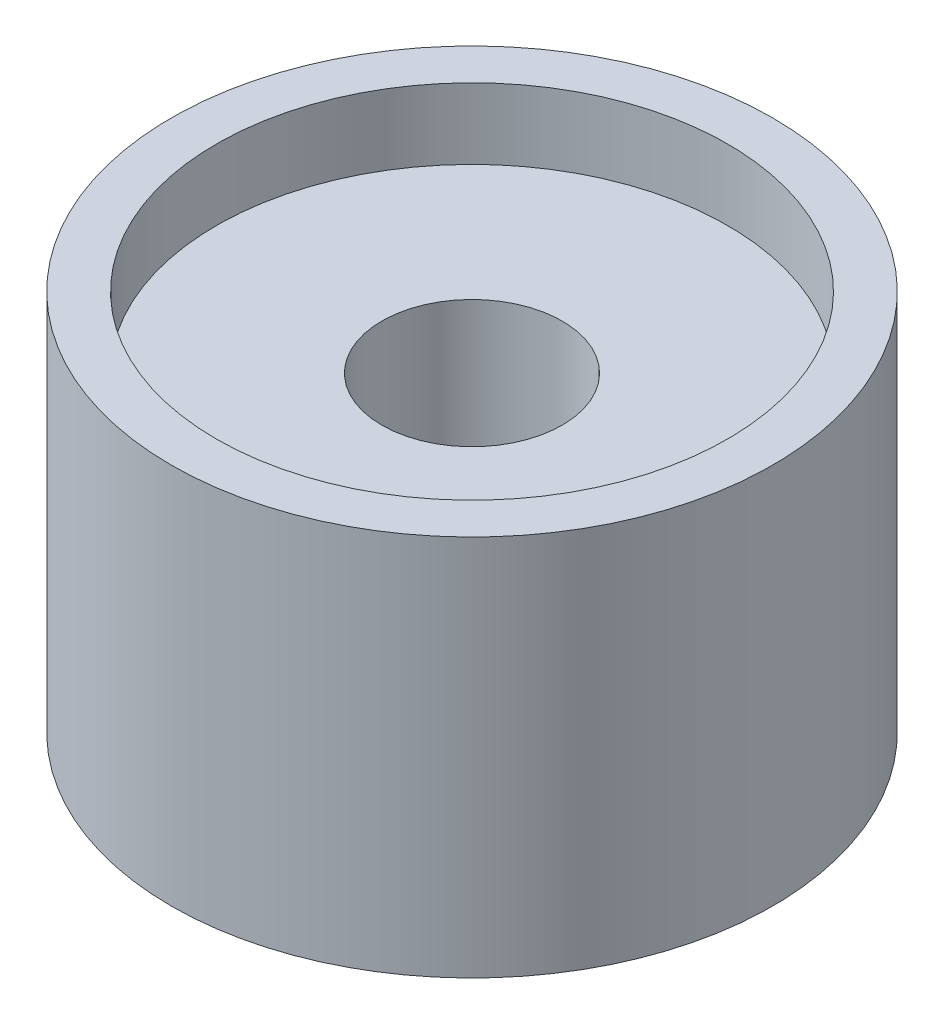
from build123d import *

# Parameters (mm, degrees)
SKETCH1_R           = 100
SKETCH1_R_2         = 85
BOSS_EXTRUDE1_DEPTH = 63.5
SKETCH4_R           = 85
SKETCH4_R_2         = 30
BOSS_EXTRUDE2_DEPTH = 40


with BuildPart() as part:
    # Sketch1 → Boss-Extrude1 (new, symmetric)
    with BuildSketch(Plane(origin=(0, 0, 0), x_dir=(1, 0, 0), z_dir=(0, 1, 0))):
        with Locations(Location((0, 0, 0), (0, 0, 270))):
            Circle(SKETCH1_R)
        with Locations(Location((0, 0, 0), (0, 0, 270))):
            Circle(SKETCH1_R_2, mode=Mode.SUBTRACT)
    extrude(amount=BOSS_EXTRUDE1_DEPTH, both=True)

    # Sketch4 → Boss-Extrude2 (add, symmetric)
    with BuildSketch(Plane(origin=(0, 0, 0), x_dir=(1, 0, 0), z_dir=(0, 1, 0))):
        with Locations(Location((0, 0, 0), (0, 0, 270))):
            Circle(SKETCH4_R)
        with Locations(Location((0, 0, 0), (0, 0, 270))):
            Circle(SKETCH4_R_2, mode=Mode.SUBTRACT)
    extrude(amount=BOSS_EXTRUDE2_DEPTH, both=True)


solid = part.part
